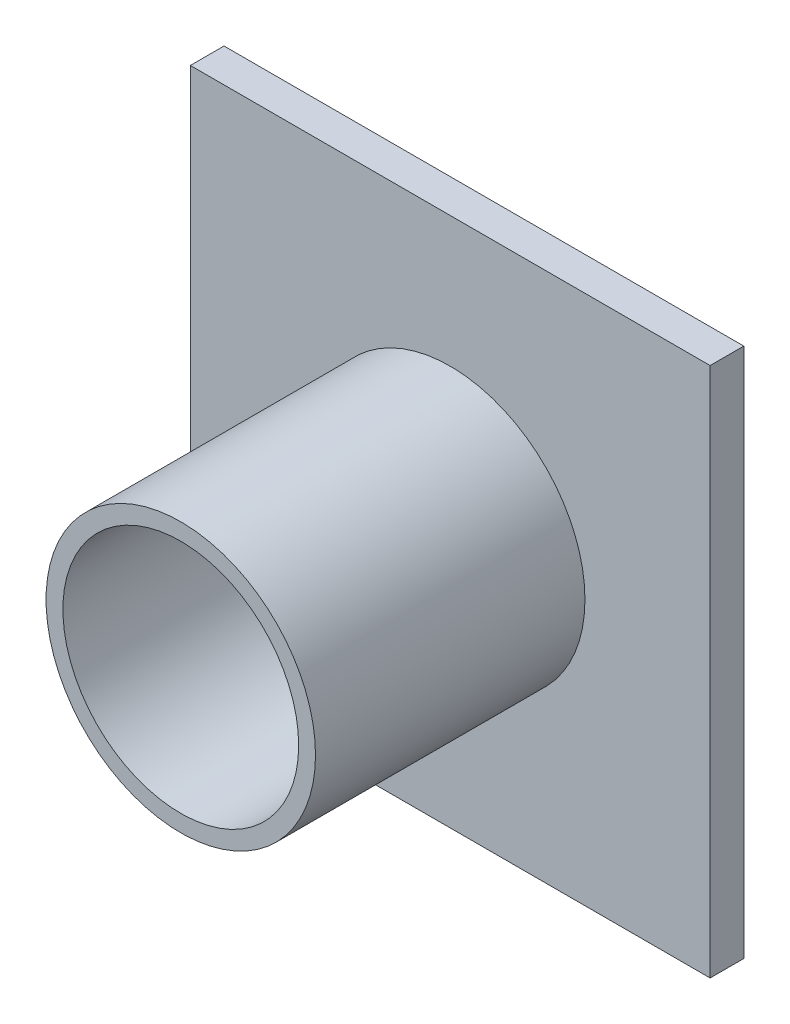
from build123d import *

# Parameters (mm, degrees)
SKETCH1_W           = 97.99
SKETCH1_H           = 100
BOSS_EXTRUDE1_DEPTH = 6.35
SKETCH2_R           = 25.4
SKETCH2_R_2         = 22.225
BOSS_EXTRUDE2_DEPTH = 50.8


with BuildPart() as part:
    # Sketch1 → Boss-Extrude1 (new body)
    with BuildSketch(Plane.XY):
        with Locations((31.114559885, -50)):
            Rectangle(SKETCH1_W, SKETCH1_H)
    extrude(amount=BOSS_EXTRUDE1_DEPTH)

    # Sketch2 → Boss-Extrude2 (add)
    with BuildSketch(Plane.XY.offset(6.35)):
        with Locations((31.114559885, -50)):
            Circle(SKETCH2_R)
        with Locations((31.114559885, -50)):
            Circle(SKETCH2_R_2, mode=Mode.SUBTRACT)
    extrude(amount=BOSS_EXTRUDE2_DEPTH)


solid = part.part
